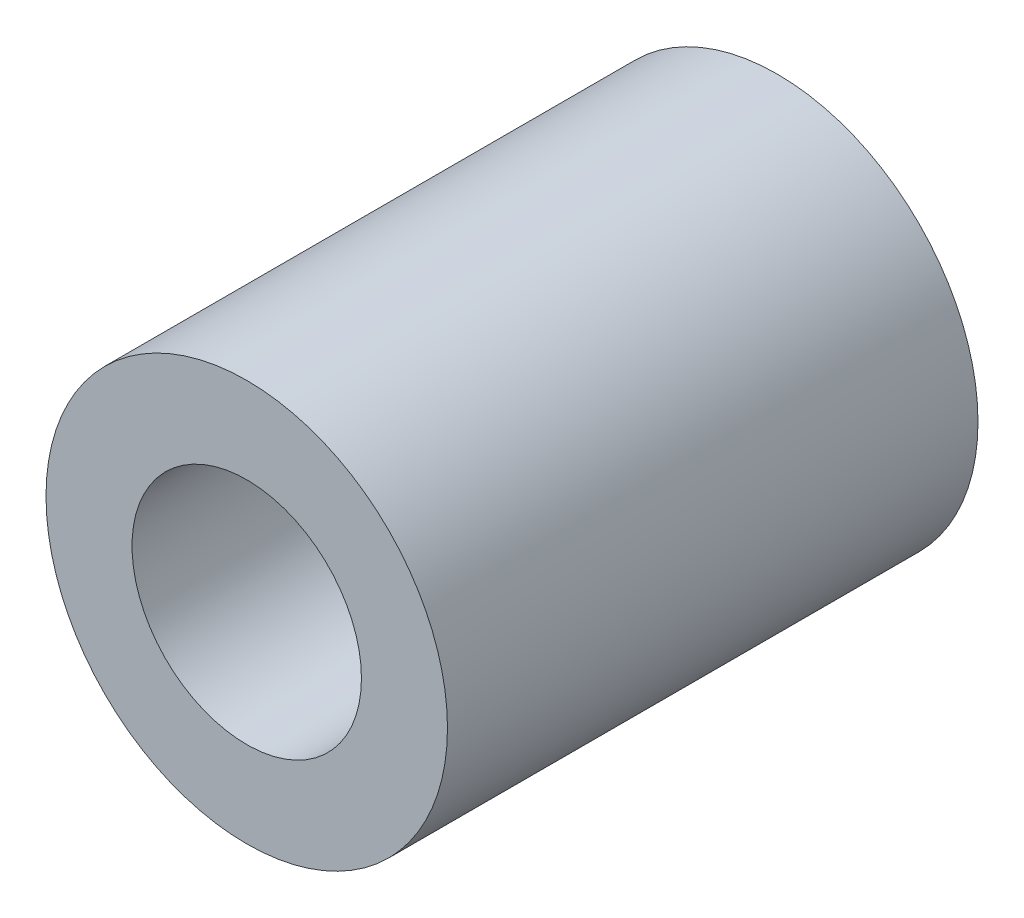
from build123d import *

# Parameters (mm, degrees)
SKETCH_1_R      = 14
SKETCH_1_R_2    = 8
EXTRUDE_1_DEPTH = 37


with BuildPart() as part:
    # 草图1 → 凸台-拉伸1 (new body)
    with BuildSketch(Plane.XY):
        Circle(SKETCH_1_R)
        Circle(SKETCH_1_R_2, mode=Mode.SUBTRACT)
    extrude(amount=EXTRUDE_1_DEPTH)


solid = part.part
